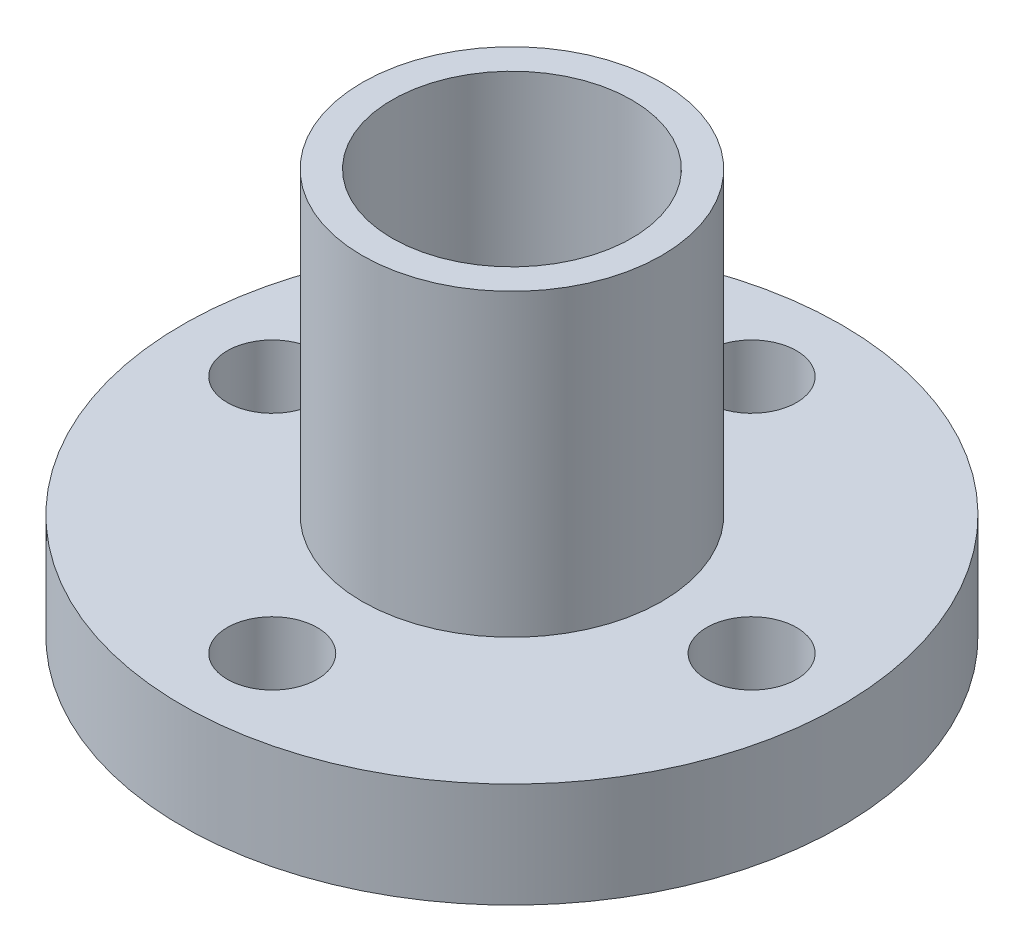
from build123d import *

# Parameters (mm, degrees)
SKETCH_2_R          = 1.5
CUT_EXTRUDE_1_DEPTH = 19.493242009


with BuildPart() as part:
    # 草图1 → 旋转1 (revolve)
    with BuildSketch(Plane.XY, mode=Mode.PRIVATE) as revolve_1_sk:
        Polygon((4, 0), (4, 15.5), (5, 15.5), (5, 5.5), (11, 5.5), (11, 2), (5, 2), (5, 0), align=None)
    revolve(revolve_1_sk.sketch.rotate(Axis((0, -4.166666667, 0), (0, 1, 0)), 90), axis=Axis((0, -4.166666667, 0), (0, 1, 0)))

    # 草图2 → 切除-拉伸1 (cut, through all)
    with BuildSketch(Plane(origin=(0, 5.5, 0), x_dir=(1, 0, 0), z_dir=(0, 1, 0))):
        with Locations(Location((0, 8, 0), (0, 0, 270))):
            Circle(SKETCH_2_R)
        with Locations(Location((8, 0, 0), (0, 0, 270))):
            Circle(SKETCH_2_R)
        with Locations(Location((0, -8, 0), (0, 0, 270))):
            Circle(SKETCH_2_R)
        with Locations(Location((-8, 0, 0), (0, 0, 270))):
            Circle(SKETCH_2_R)
    extrude(amount=-CUT_EXTRUDE_1_DEPTH, mode=Mode.SUBTRACT)


solid = part.part
